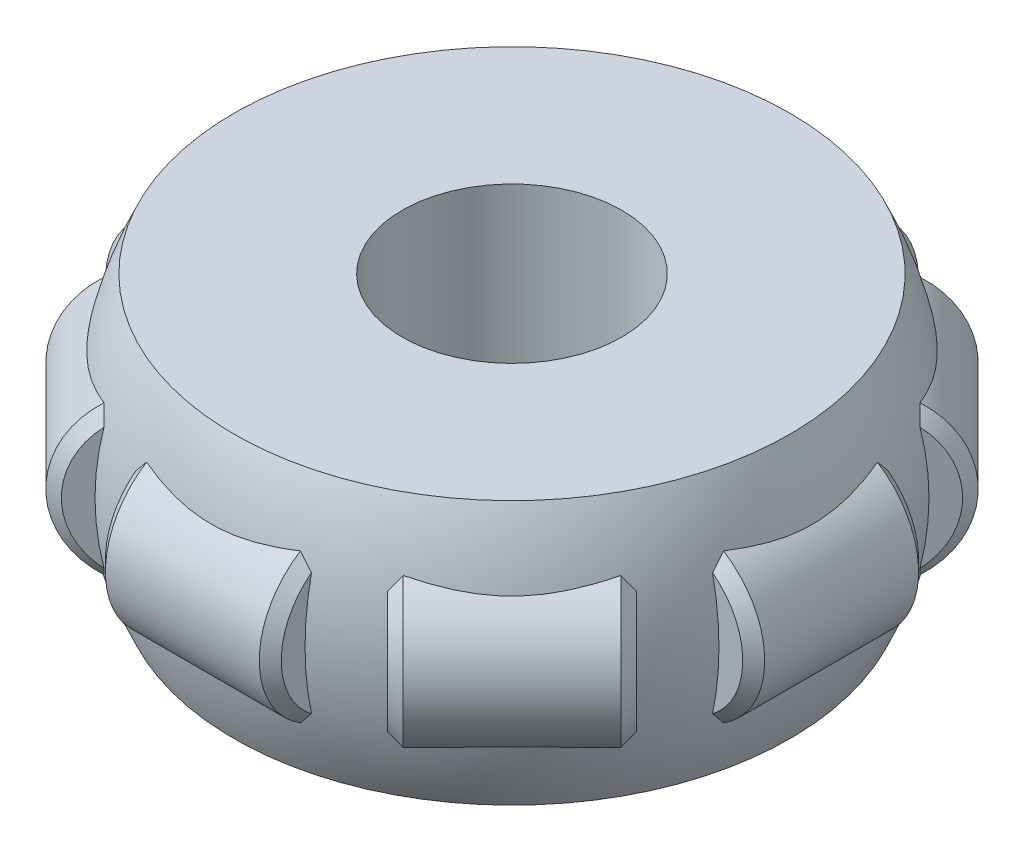
from build123d import *

# Parameters (mm, degrees)
SKETCH_3_W                           = 8
SKETCH_3_H                           = 4
CHAMFER_1_SIZE                       = 0.5
PATTERN_CIRCULAR_1_COUNT             = 8
CHAMFER_1_OF_PATTERN_CIRCULAR_1_SIZE = 0.5


with BuildPart() as part:
    # 草图5 → 旋转1 (revolve)
    with BuildSketch(Plane.XY):
        with BuildLine():
            Line((5, 6), (5, -6))
            Line((5, -6), (12.649110641, -6))
            ThreePointArc((12.649110641, -6), (14, 0), (12.649110641, 6))
            Line((12.649110641, 6), (5, 6))
        make_face()
    revolve(axis=Axis((0, 0, 0), (0, 1, 0)))

    # 草图3 → 旋转2 (revolve)
    with BuildSketch(Plane(origin=(0, 0, 0), x_dir=(1, 0, 0), z_dir=(0, 1, 0))):
        with Locations((0, 13)):
            Rectangle(SKETCH_3_W, SKETCH_3_H)
    revolve_2 = revolve(axis=Axis((-4, 0, -11), (1, 0, 0)))

    # 倒角1
    chamfer_1_edges = [part.edges().sort_by_distance(p)[0] for p in [
        (-4, 0, -15),
        (4, 0, -15),
    ]]
    chamfer(chamfer_1_edges, length=CHAMFER_1_SIZE)

    # 阵列(圆周)1: 旋转2 ×8 about axis
    pattern_circular_1_axis = Axis((0, 0, 0), (0, 1, 0))
    for i in range(1, PATTERN_CIRCULAR_1_COUNT):
        add(revolve_2.rotate(pattern_circular_1_axis, i * 360 / PATTERN_CIRCULAR_1_COUNT))

    # 倒角1 of 阵列(圆周)1
    chamfer_1_of_pattern_circular_1_edges = [part.edges().sort_by_distance(p)[0] for p in [
        (-13.435028843, 0, -7.778174593),
        (-7.778174593, 0, -13.435028843),
        (-15, 0, 4),
        (-15, 0, -4),
        (-7.778174593, 0, 13.435028843),
        (-13.435028843, 0, 7.778174593),
        (4, 0, 15),
        (-4, 0, 15),
        (13.435028843, 0, 7.778174593),
        (7.778174593, 0, 13.435028843),
        (15, 0, -4),
        (15, 0, 4),
        (7.778174593, 0, -13.435028843),
        (13.435028843, 0, -7.778174593),
    ]]
    chamfer(chamfer_1_of_pattern_circular_1_edges, length=CHAMFER_1_OF_PATTERN_CIRCULAR_1_SIZE)


solid = part.part
